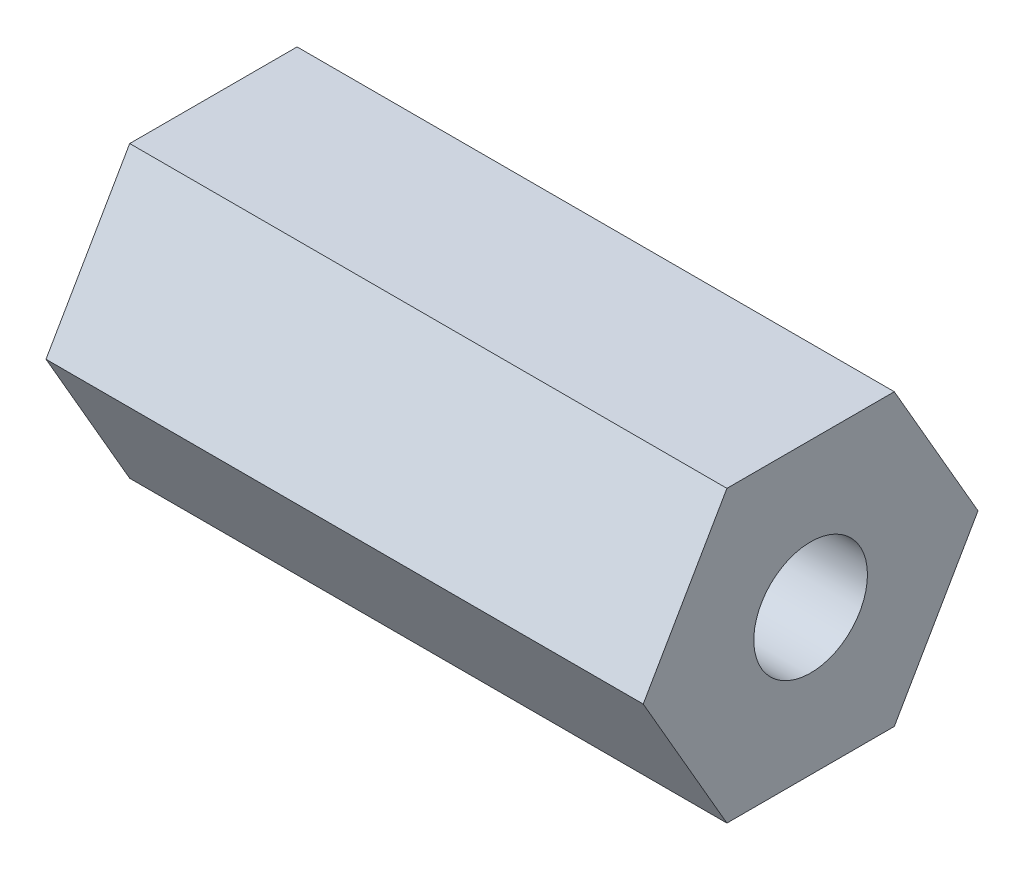
from build123d import *

# Parameters (mm, degrees)
SKETCH1_R           = 2.4892
BOSS_EXTRUDE1_DEPTH = 26.162


with BuildPart() as part:
    # Sketch1 → Boss-Extrude1 (new body)
    with BuildSketch(Plane(origin=(0, 0, 0), x_dir=(0, 0, -1), z_dir=(1, 0, 0))):
        Polygon((7.332348419, 0), (3.666174209, 6.35), (-3.666174209, 6.35), (-7.332348419, 0), (-3.666174209, -6.35), (3.666174209, -6.35), align=None)
        Circle(SKETCH1_R, mode=Mode.SUBTRACT)
    extrude(amount=BOSS_EXTRUDE1_DEPTH)


solid = part.part
